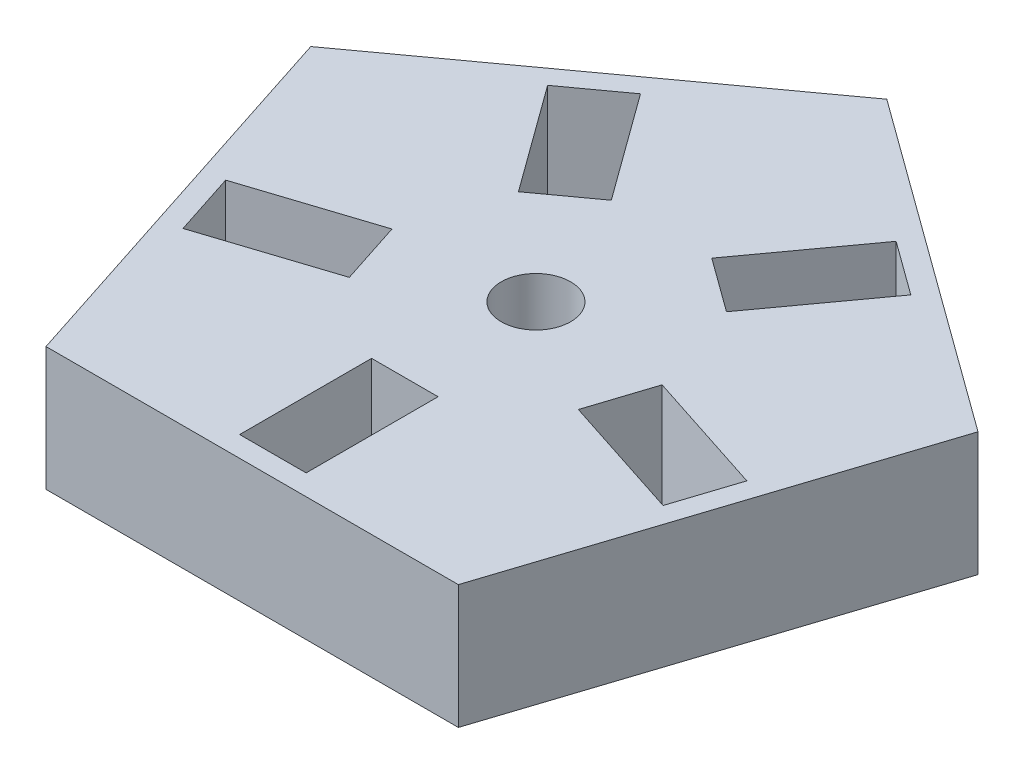
from build123d import *

# Parameters (mm, degrees)
BOSS_EXTRUDE2_DEPTH = 38.1
SKETCH5_W           = 20.4724
SKETCH5_H           = 40.64
CUT_EXTRUDE2_DEPTH  = 154.893000964
CIRPATTERN1_COUNT   = 5
SKETCH6_R           = 10.680701414
CUT_EXTRUDE3_DEPTH  = 154.893000964


with BuildPart() as part:
    # Sketch4 → Boss-Extrude2 (new body)
    with BuildSketch(Plane(origin=(0, 0, 0), x_dir=(1, 0, 0), z_dir=(0, 1, 0))):
        Polygon((-102.747316485, 33.402541556), (0, 108.048298), (102.743, 33.396600424), (63.494349621, -87.38644244), (-63.505650326, -87.382770618), align=None)
    extrude(amount=BOSS_EXTRUDE2_DEPTH)

    # Sketch5 → Cut-Extrude2 (cut, through all)
    with BuildSketch(Plane(origin=(0, 38.1, 0), x_dir=(1, 0, 0), z_dir=(0, 1, 0))):
        with Locations((0.019749621, -60.714607261)):
            Rectangle(SKETCH5_W, SKETCH5_H)
    cut_extrude2 = extrude(amount=-CUT_EXTRUDE2_DEPTH, mode=Mode.SUBTRACT)

    # CirPattern1: Cut-Extrude2 ×5 about axis
    cirpattern1_axis = Axis((0, -1.905, 0), (0, 1, 0))
    for i in range(1, CIRPATTERN1_COUNT):
        add(cut_extrude2.rotate(cirpattern1_axis, i * 360 / CIRPATTERN1_COUNT), mode=Mode.SUBTRACT)

    # Sketch6 → Cut-Extrude3 (cut, through all)
    with BuildSketch(Plane.XZ):
        Circle(SKETCH6_R)
    extrude(amount=-CUT_EXTRUDE3_DEPTH, mode=Mode.SUBTRACT)


solid = part.part
